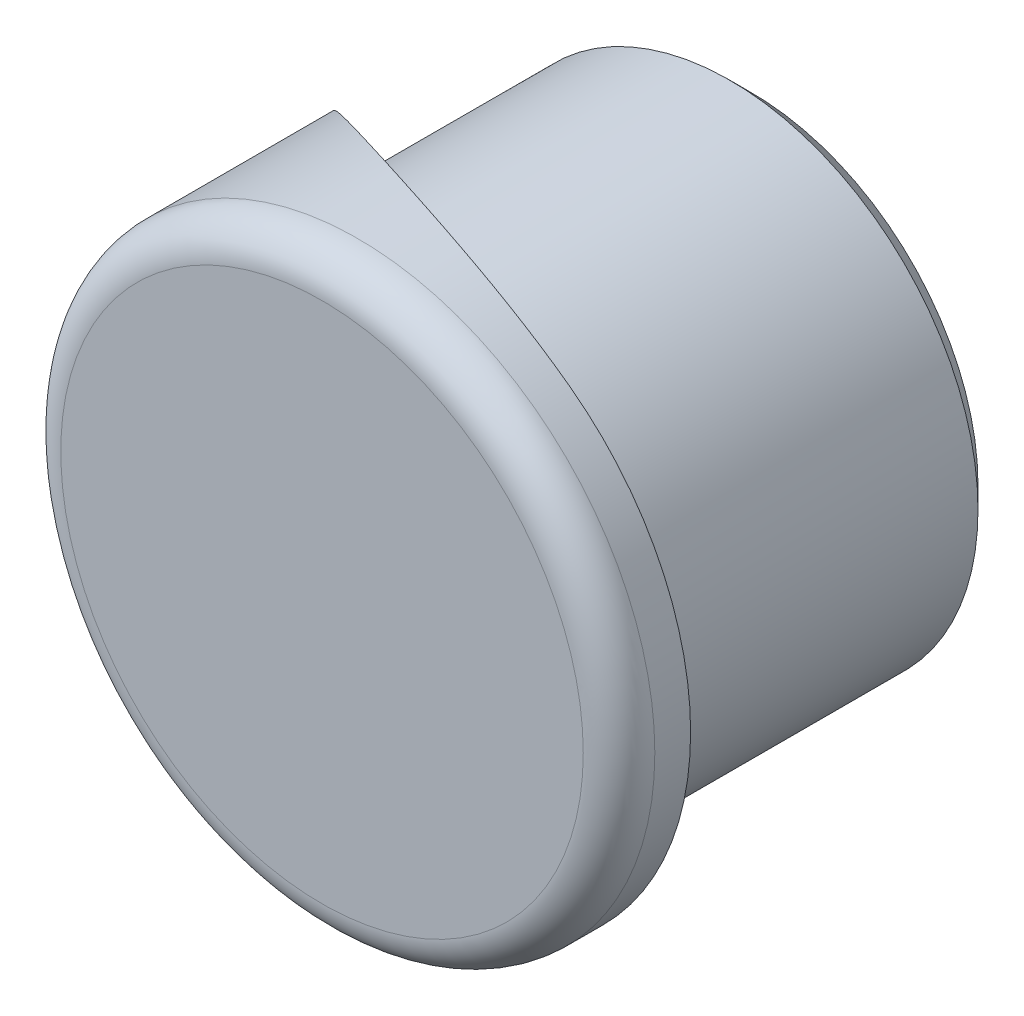
from build123d import *

# Parameters (mm, degrees)
ESQUISSE1_R                  = 3.465
BOSS_EXTRU_1_DEPTH           = 5
ESQUISSE2_R                  = 4.15
BOSS_EXTRU_2_DEPTH           = 1
CONG_1_R                     = 0.5
BOSS_EXTRU_3_DEPTH           = 9
BOSS_EXTRU_3_DEPTH_BACK      = 2
ENL_V_START                  = -8
ENL_V_MAT_EXTRU_1_DEPTH      = 8
CHANFREIN1_SIZE              = 0.3
ENL_V_MAT_EXTRU_2_REACH      = 84.915
ENL_V_MAT_EXTRU_2_END_RADIUS = 8


with BuildPart() as part:
    # Esquisse1 → Boss.-Extru.1 (new body)
    with BuildSketch(Plane.XY):
        with Locations((-38, 67)):
            Circle(ESQUISSE1_R)
    extrude(amount=-BOSS_EXTRU_1_DEPTH)

    # Esquisse2 → Boss.-Extru.2 (add)
    with BuildSketch(Plane.XY):
        with Locations((-38, 67)):
            Circle(ESQUISSE2_R)
    extrude(amount=BOSS_EXTRU_2_DEPTH)

    # Congé1
    cong_1_edges = [part.edges().sort_by_distance(p)[0] for p in [
        (-42.15, 67, 1),
    ]]
    fillet(cong_1_edges, radius=CONG_1_R)

    # Esquisse4 → Boss.-Extru.3 (add, two sides: drawn at the far end of the back side and taken through both)
    with BuildSketch(Plane(origin=(29.785, 71.15, 0), x_dir=(0, 0, 1), z_dir=(0, -1, 0)).offset(-BOSS_EXTRU_3_DEPTH_BACK)):
        with BuildLine():
            Line((0, 71.935), (-3.500913982, 71.935))
            ThreePointArc((-3.500913982, 71.935), (-0.929190706, 69.062145899), (0, 65.32))
            Line((0, 65.32), (0, 71.935))
        make_face()
    extrude(amount=BOSS_EXTRU_3_DEPTH + BOSS_EXTRU_3_DEPTH_BACK)

    # Esquisse5 → Enlèv. mat.-Extru.1 (cut)
    with BuildSketch(Plane.XY.offset(1).offset(ENL_V_START)):
        with BuildLine():
            Line((-35.535, 63.66139625), (-34.484183595, 58.91127048))
            Line((-34.484183595, 58.91127048), (-43.808246532, 59.466119951))
            Line((-43.808246532, 59.466119951), (-42.997006725, 73.486489438))
            Line((-42.997006725, 73.486489438), (-34.816687162, 73.486489438))
            Line((-34.816687162, 73.486489438), (-35.535, 70.33860375))
            ThreePointArc((-35.535, 70.33860375), (-39.86985962, 70.704878541), (-42.15, 67))
            ThreePointArc((-42.15, 67), (-39.86985962, 63.295121459), (-35.535, 63.66139625))
        make_face()
    extrude(amount=ENL_V_MAT_EXTRU_1_DEPTH, mode=Mode.SUBTRACT)

    # Chanfrein1
    chanfrein1_edges = [part.edges().sort_by_distance(p)[0] for p in [
        (-41.465, 67, -5),
    ]]
    chamfer(chanfrein1_edges, length=CHANFREIN1_SIZE)

    # Enlèv. mat.-Extru.2: up to this cylinder (the profile starts inside it)
    enl_v_mat_extru_2_end = Plane(origin=(-35.535, 63.654799, -8), z_dir=(0, -1, 0)) * Cylinder(ENL_V_MAT_EXTRU_2_END_RADIUS, 186.83, mode=Mode.PRIVATE)
    # Esquisse7 → Enlèv. mat.-Extru.2 (cut, up to the surface)
    with BuildSketch(Plane(origin=(0, 0, -5), x_dir=(-1, 0, 0), z_dir=(0, 0, -1)), mode=Mode.PRIVATE) as enl_v_mat_extru_2_sk1:
        with BuildLine():
            Line((39.160172401, 63.735), (36.839827599, 63.735))
            ThreePointArc((36.839827599, 63.735), (38, 63.535), (39.160172401, 63.735))
        make_face()
    enl_v_mat_extru_2_tool1 = extrude(enl_v_mat_extru_2_sk1.sketch, amount=-ENL_V_MAT_EXTRU_2_REACH, mode=Mode.PRIVATE) & enl_v_mat_extru_2_end
    add(enl_v_mat_extru_2_tool1.solids().sort_by_distance((-38, 63.654799, -5))[0], mode=Mode.SUBTRACT)


solid = part.part
